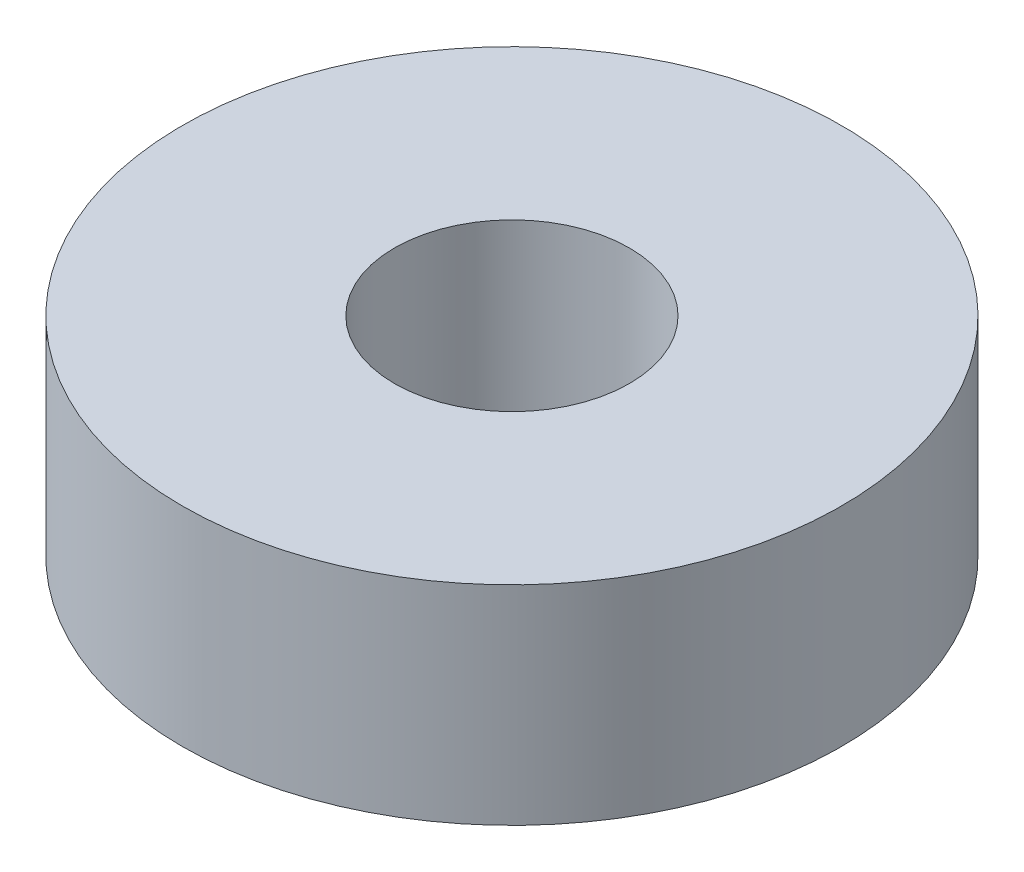
from build123d import *

# Parameters (mm, degrees)
SKETCH1_R           = 11.01
SKETCH1_R_2         = 3.925
BOSS_EXTRUDE1_DEPTH = 6.96


with BuildPart() as part:
    # Sketch1 → Boss-Extrude1 (new body)
    with BuildSketch(Plane(origin=(0, 0, 0), x_dir=(1, 0, 0), z_dir=(0, 1, 0))):
        with Locations(Location((0, 0, 0), (0, 0, 270))):
            Circle(SKETCH1_R)
        with Locations(Location((0, 0, 0), (0, 0, 270))):
            Circle(SKETCH1_R_2, mode=Mode.SUBTRACT)
    extrude(amount=BOSS_EXTRUDE1_DEPTH)


solid = part.part
